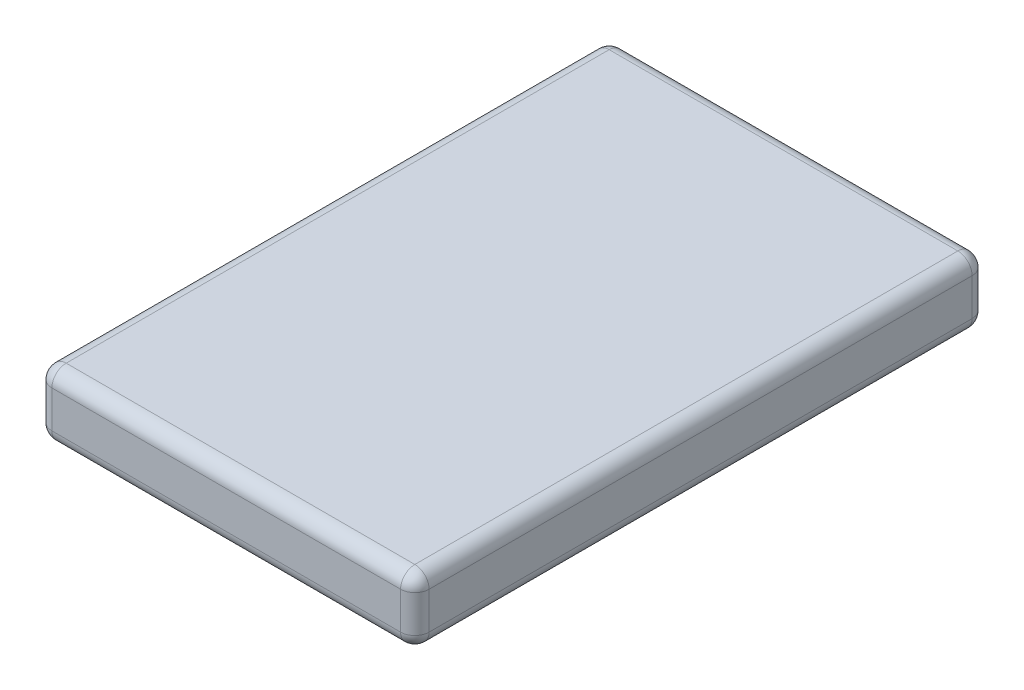
from build123d import *

# Parameters (mm, degrees)
SKETCH1_W           = 33.528
SKETCH1_H           = 50.8
BOSS_EXTRUDE1_DEPTH = 5.842
FILLET1_R           = 1.27


with BuildPart() as part:
    # Sketch1 → Boss-Extrude1 (new body)
    with BuildSketch(Plane(origin=(0, 0, 0), x_dir=(1, 0, 0), z_dir=(0, 1, 0))):
        with Locations((16.764, 25.4)):
            Rectangle(SKETCH1_W, SKETCH1_H)
    extrude(amount=BOSS_EXTRUDE1_DEPTH)

    # Fillet1
    fillet1_edges = [part.edges().sort_by_distance(p)[0] for p in [
        (33.528, 5.842, -25.4),
        (16.764, 5.842, -50.8),
        (0, 5.842, -25.4),
        (16.764, 0, -50.8),
        (33.528, 0, -25.4),
        (16.764, 0, 0),
        (0, 0, -25.4),
        (16.764, 5.842, 0),
        (0, 2.921, -50.8),
        (33.528, 2.921, -50.8),
        (33.528, 2.921, 0),
        (0, 2.921, 0),
    ]]
    fillet(fillet1_edges, radius=FILLET1_R)


solid = part.part
